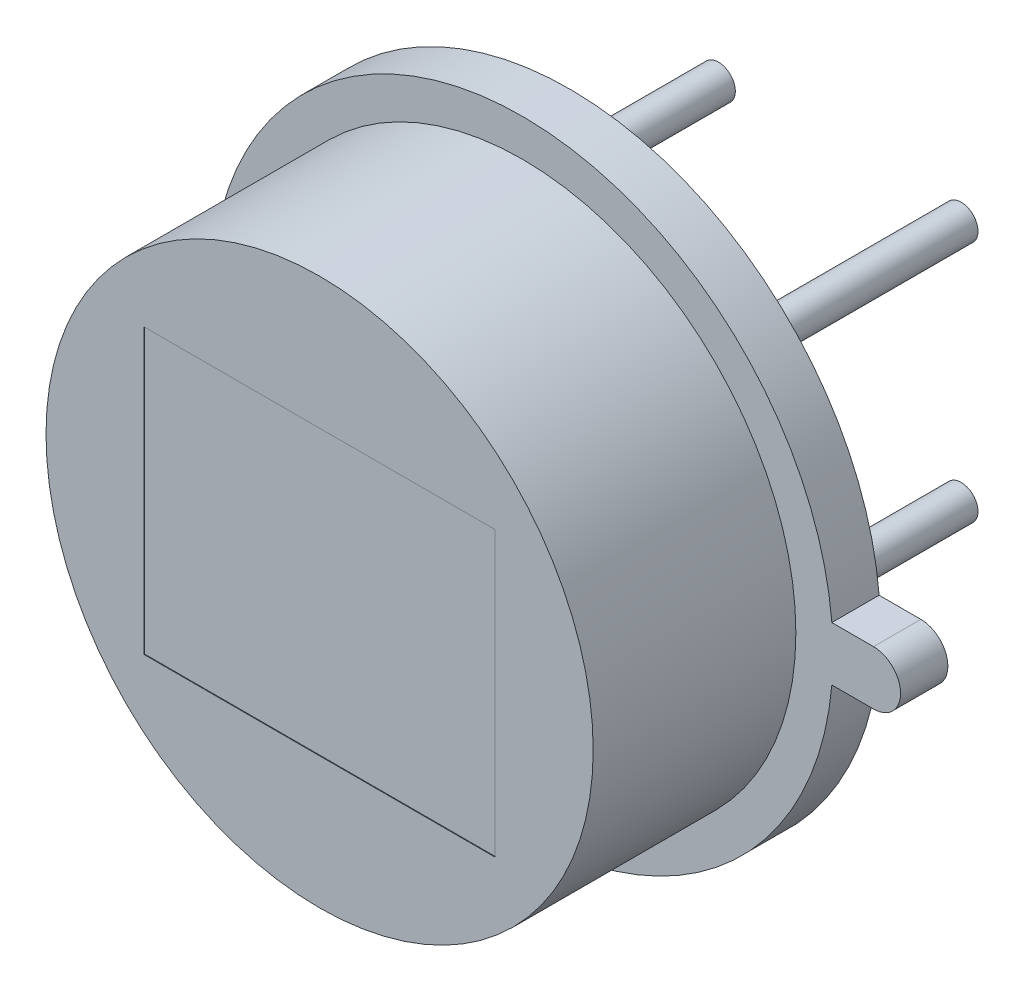
from build123d import *

# Parameters (mm, degrees)
EXTRUDE_1_DEPTH     = 0.7
SKETCH_2_R          = 4.05
EXTRUDE_2_DEPTH     = 3
SKETCH_3_W          = 5.2
SKETCH_3_H          = 4.2
CUT_EXTRUDE_1_DEPTH = 0.01
SKETCH_4_R          = 0.25
EXTRUDE_3_DEPTH     = 4


with BuildPart() as part:
    # Эскиз1 → Бобышка-Вытянуть1 (new body)
    with BuildSketch(Plane.XY):
        with BuildLine():
            Line((5.2, 0.4), (4.582575695, 0.4))
            ThreePointArc((4.582575695, 0.4), (-4.6, 0), (4.582575695, -0.4))
            Line((4.582575695, -0.4), (5.2, -0.4))
            ThreePointArc((5.2, -0.4), (5.6, 0), (5.2, 0.4))
        make_face()
    extrude(amount=EXTRUDE_1_DEPTH)

    # Эскиз2 → Бобышка-Вытянуть2 (add)
    with BuildSketch(Plane.XY.offset(0.7)):
        Circle(SKETCH_2_R)
    extrude(amount=EXTRUDE_2_DEPTH)

    # Эскиз3 → Вырез-Вытянуть1 (cut)
    with BuildSketch(Plane.XY.offset(3.7)):
        Rectangle(SKETCH_3_W, SKETCH_3_H)
    extrude(amount=-CUT_EXTRUDE_1_DEPTH, mode=Mode.SUBTRACT)

    # Эскиз4 → Бобышка-Вытянуть3 (add)
    with BuildSketch(Plane.XY):
        with Locations((1.796, -1.796)):
            Circle(SKETCH_4_R)
        with Locations((1.796, 1.796)):
            Circle(SKETCH_4_R)
        with Locations((-1.796, 1.796)):
            Circle(SKETCH_4_R)
        with Locations((-1.796, -1.796)):
            Circle(SKETCH_4_R)
    extrude(amount=-EXTRUDE_3_DEPTH)


solid = part.part
